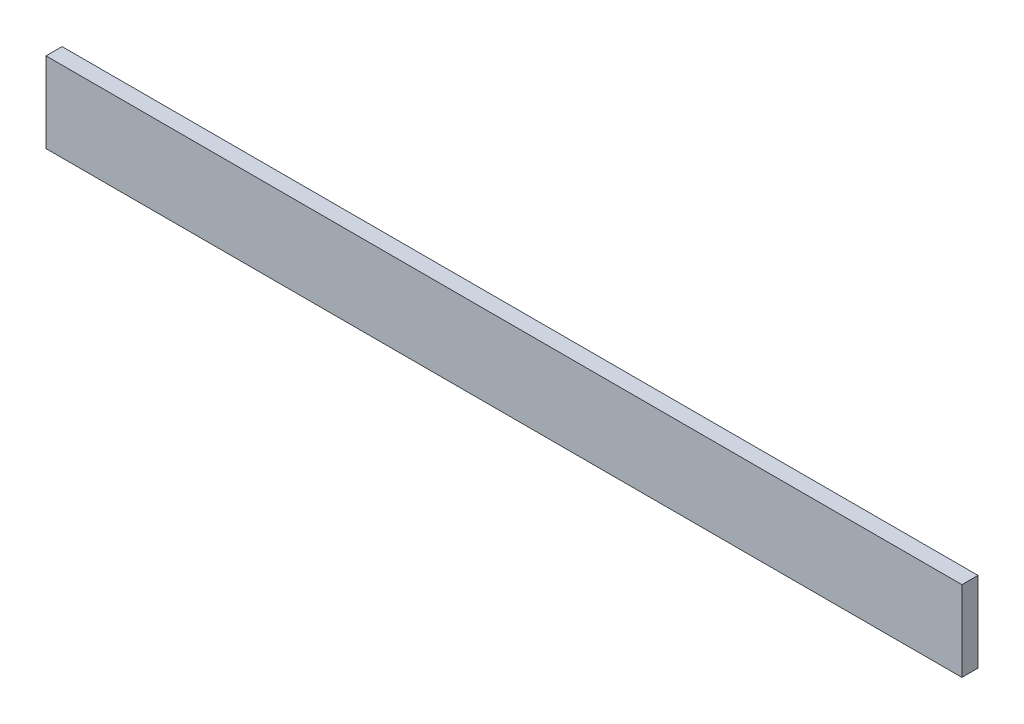
from build123d import *

# Parameters (mm, degrees)
SKETCH2_W           = 723.9
SKETCH2_H           = 63.5
BOSS_EXTRUDE1_DEPTH = 12.7


with BuildPart() as part:
    # Sketch2 → Boss-Extrude1 (new body)
    with BuildSketch(Plane.XY):
        with Locations((361.95, 31.75)):
            Rectangle(SKETCH2_W, SKETCH2_H)
    extrude(amount=BOSS_EXTRUDE1_DEPTH)


solid = part.part
